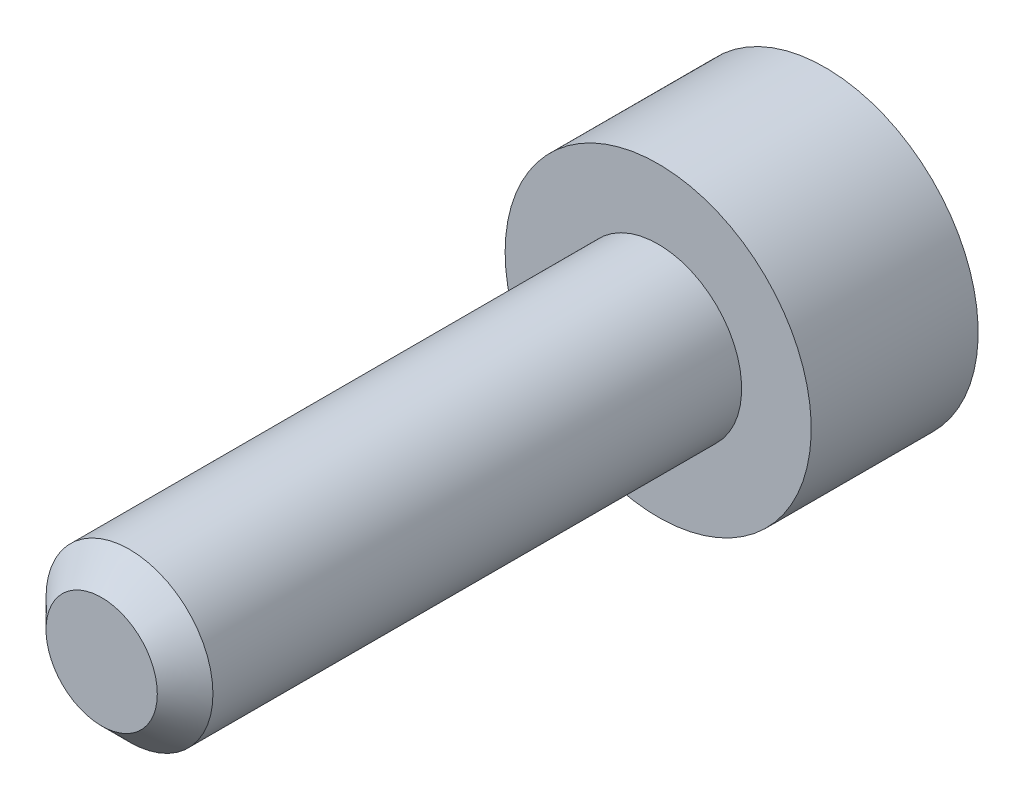
from build123d import *

# Parameters (mm, degrees)
ESQUISSE2_R      = 1.5
EXTRUSION1_DEPTH = 10
ESQUISSE3_R      = 2.75
EXTRUSION2_DEPTH = 3
CHANFREIN1_SIZE  = 0.5


with BuildPart() as part:
    # Esquisse2 → Extrusion1 (new body)
    with BuildSketch(Plane.XY):
        Circle(ESQUISSE2_R)
    extrude(amount=EXTRUSION1_DEPTH)

    # Esquisse3 → Extrusion2 (add)
    with BuildSketch(Plane(origin=(0, 0, 0), x_dir=(-1, 0, 0), z_dir=(0, 0, -1))):
        Circle(ESQUISSE3_R)
    extrude(amount=EXTRUSION2_DEPTH)

    # Chanfrein1
    chanfrein1_edges = [part.edges().sort_by_distance(p)[0] for p in [
        (-1.5, 0, 10),
    ]]
    chamfer(chanfrein1_edges, length=CHANFREIN1_SIZE)


solid = part.part
